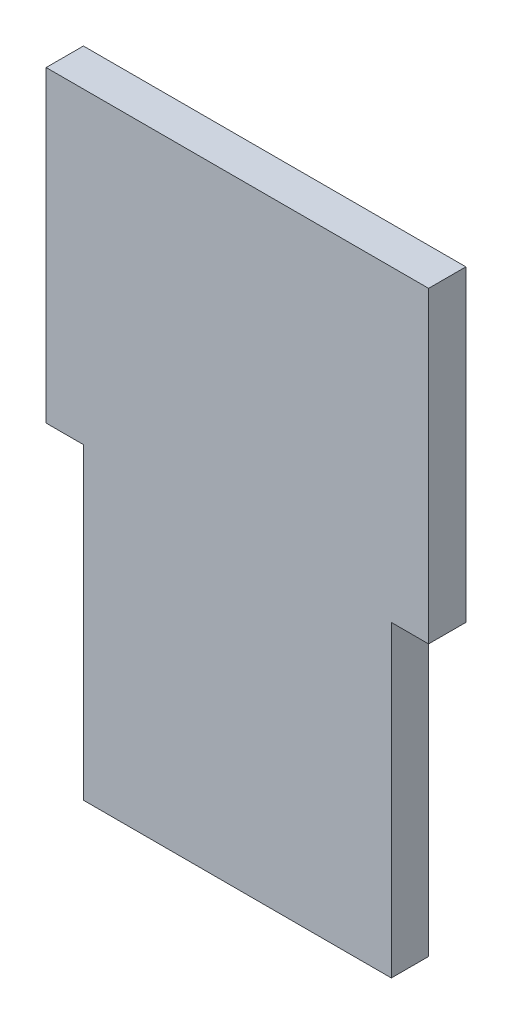
from build123d import *

# Parameters (mm, degrees)
BOSS_EXTRUDE1_DEPTH = 3.0734


with BuildPart() as part:
    # Sketch1 → Boss-Extrude1 (new body)
    with BuildSketch(Plane.XY):
        Polygon((25.4, 0), (25.4, 25.4), (28.4734, 25.4), (28.4734, 50.8), (-3.0734, 50.8), (-3.0734, 25.4), (0, 25.4), (0, 0), align=None)
    extrude(amount=BOSS_EXTRUDE1_DEPTH)


solid = part.part
